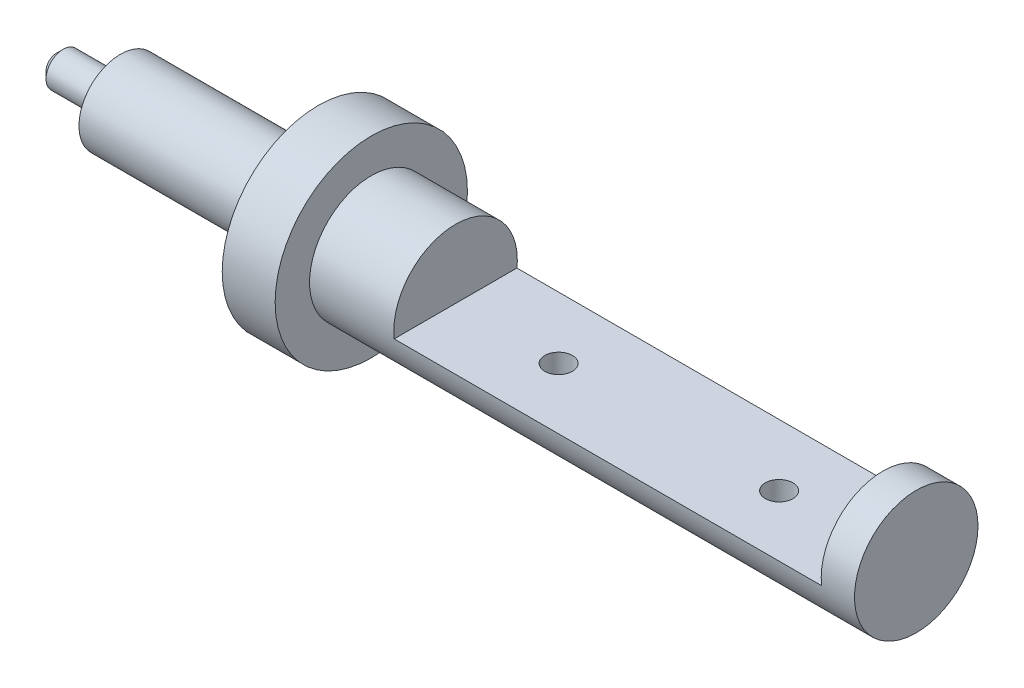
from build123d import *

# Parameters (mm, degrees)
CUT_EXTRUDE1_DEPTH      = 395.646626743
CUT_EXTRUDE1_DEPTH_BACK = 395.646626743
SKETCH2_W               = 193.8
SKETCH2_H               = 31.1
CUT_EXTRUDE2_DEPTH      = 396.001126581
CUT_EXTRUDE2_DEPTH_BACK = 396.001126581
SKETCH3_R               = 6.25


with BuildPart() as part:
    # Sketch1 → Revolve1 (revolve)
    with BuildSketch(Plane.XY, mode=Mode.PRIVATE) as revolve1_sk:
        Polygon((0, 0), (0, 28), (-247.1, 28), (-247.1, 43.6), (-271.1, 43.6), (-271.1, 18.75), (-360.9, 18.75), (-360.9, 7.796453039), (-386.8, 7.796453039), (-389.8, 4.796453039), (-389.8, 0), align=None)
    revolve(revolve1_sk.sketch.rotate(Axis((0, 0, 0), (-1, 0, 0)), 90), axis=Axis((0, 0, 0), (-1, 0, 0)))

    # Sketch2 → Cut-Extrude1 (cut, two sides: drawn at the far end of the back side and taken through both)
    with BuildSketch(Plane.XY.offset(-CUT_EXTRUDE1_DEPTH_BACK)):
        with Locations((-112, 12.45)):
            Rectangle(SKETCH2_W, SKETCH2_H)
    extrude(amount=CUT_EXTRUDE1_DEPTH + CUT_EXTRUDE1_DEPTH_BACK, mode=Mode.SUBTRACT)

    # Sketch3 → Cut-Extrude2 (cut, two sides: drawn at the far end of the back side and taken through both)
    with BuildSketch(Plane(origin=(0, -3.1, 0), x_dir=(1, 0, 0), z_dir=(0, 1, 0)).offset(-CUT_EXTRUDE2_DEPTH_BACK)):
        with Locations(Location((-162, -0.172136266, 0), (0, 0, 180))):
            Circle(SKETCH3_R)
        with Locations(Location((-62, -0.172136266, 0), (0, 0, 180))):
            Circle(SKETCH3_R)
    extrude(amount=CUT_EXTRUDE2_DEPTH + CUT_EXTRUDE2_DEPTH_BACK, mode=Mode.SUBTRACT)


solid = part.part
